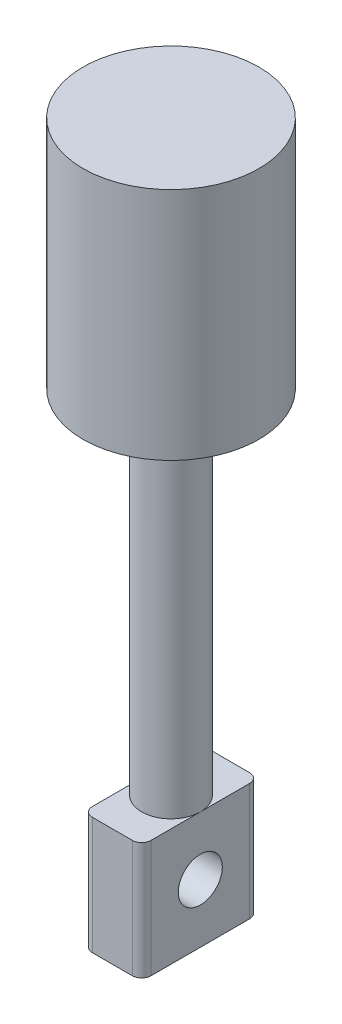
from build123d import *

# Parameters (mm, degrees)
SKETCH2_R           = 4.7625
BOSS_EXTRUDE2_DEPTH = 12.7
SKETCH3_R           = 1.5875
BOSS_EXTRUDE3_DEPTH = 19.05
SKETCH4_W           = 6.35
SKETCH4_H           = 6.35
SKETCH4_R           = 1.190625
BOSS_EXTRUDE4_DEPTH = 1.5875
FILLET2_R           = 0.508


with BuildPart() as part:
    # Sketch2 → Boss-Extrude2 (new body)
    with BuildSketch(Plane(origin=(0, 0, 0), x_dir=(1, 0, 0), z_dir=(0, 1, 0))):
        with Locations(Location((0, 0, 0), (0, 0, 270))):
            Circle(SKETCH2_R)
    extrude(amount=-BOSS_EXTRUDE2_DEPTH)

    # Sketch3 → Boss-Extrude3 (add)
    with BuildSketch(Plane.XZ.offset(12.7)):
        with Locations(Location((0, 0, 0), (0, 0, 90))):
            Circle(SKETCH3_R)
    extrude(amount=BOSS_EXTRUDE3_DEPTH)

    # Sketch4 → Boss-Extrude4 (add, symmetric)
    with BuildSketch(Plane(origin=(0, 0, 0), x_dir=(0, 0, -1), z_dir=(1, 0, 0))):
        with Locations((0, -34.925)):
            Rectangle(SKETCH4_W, SKETCH4_H)
        with Locations((0, -34.925)):
            Circle(SKETCH4_R, mode=Mode.SUBTRACT)
    extrude(amount=BOSS_EXTRUDE4_DEPTH, both=True)

    # Fillet2
    fillet2_edges = [part.edges().sort_by_distance(p)[0] for p in [
        (1.5875, -34.925, 3.175),
        (1.5875, -34.925, -3.175),
        (-1.5875, -34.925, 3.175),
        (-1.5875, -34.925, -3.175),
    ]]
    fillet(fillet2_edges, radius=FILLET2_R)


solid = part.part
